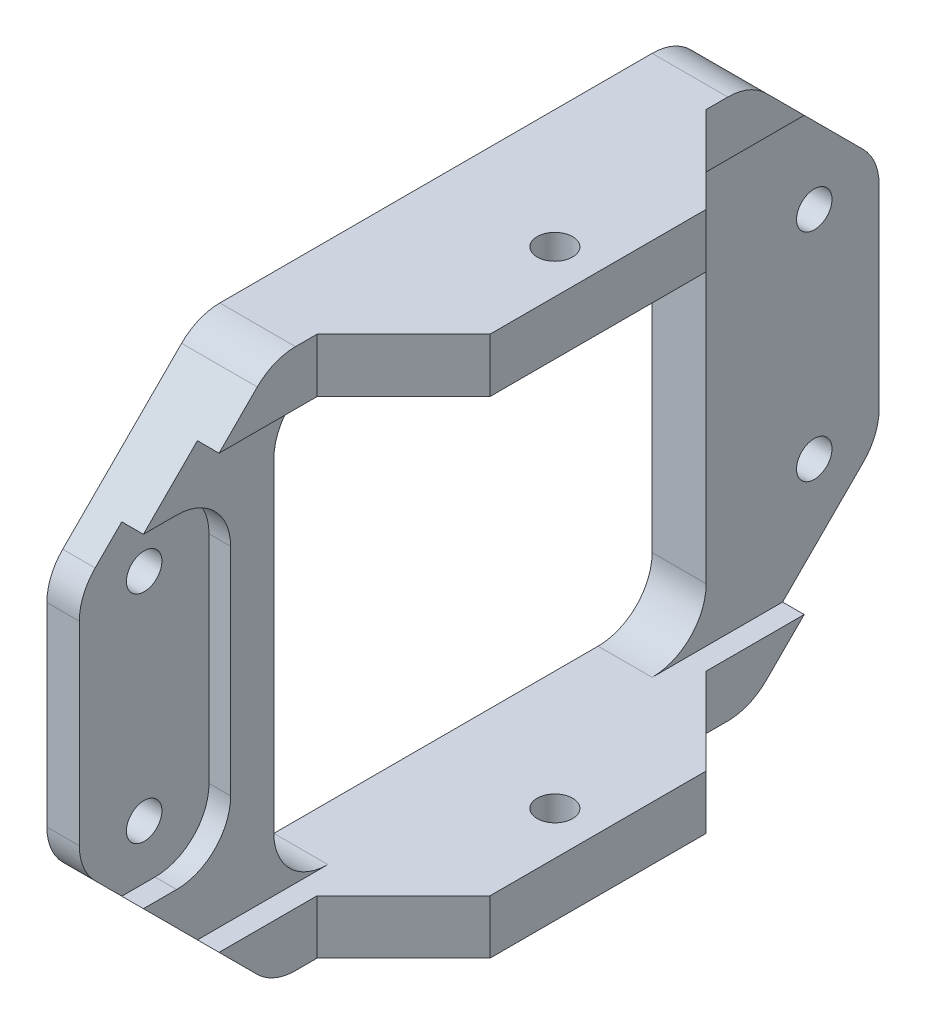
from build123d import *

# Parameters (mm, degrees)
SKETCH1_R           = 2.0828
BOSS_EXTRUDE1_DEPTH = 6.35
BOSS_EXTRUDE2_DEPTH = 12.7
SKETCH3_W           = 10.16
SKETCH3_H           = 8.980256121
SKETCH3_R           = 2.0828
CUT_EXTRUDE2_DEPTH  = 81.532421421
CUT_EXTRUDE3_DEPTH  = 2.54


with BuildPart() as part:
    # Sketch1 → Boss-Extrude1 (new body)
    with BuildSketch(Plane(origin=(0, 0, 0), x_dir=(0, 0, -1), z_dir=(1, 0, 0))):
        with BuildLine():
            Line((-25.4, 31.75), (25.4, 31.75))
            ThreePointArc((25.4, 31.75), (27.830039796, 31.266635031), (29.890128061, 29.890128061))
            Line((29.890128061, 29.890128061), (43.860128061, 15.920128061))
            ThreePointArc((43.860128061, 15.920128061), (45.236635031, 13.860039796), (45.72, 11.43))
            Line((45.72, 11.43), (45.72, -11.43))
            ThreePointArc((45.72, -11.43), (45.236635031, -13.860039796), (43.860128061, -15.920128061))
            Line((43.860128061, -15.920128061), (29.890128061, -29.890128061))
            ThreePointArc((29.890128061, -29.890128061), (27.830039796, -31.266635031), (25.4, -31.75))
            Line((25.4, -31.75), (-25.4, -31.75))
            ThreePointArc((-25.4, -31.75), (-27.830039796, -31.266635031), (-29.890128061, -29.890128061))
            Line((-29.890128061, -29.890128061), (-43.860128061, -15.920128061))
            ThreePointArc((-43.860128061, -15.920128061), (-45.236635031, -13.860039796), (-45.72, -11.43))
            Line((-45.72, -11.43), (-45.72, 11.43))
            ThreePointArc((-45.72, 11.43), (-45.236635031, 13.860039796), (-43.860128061, 15.920128061))
            Line((-43.860128061, 15.920128061), (-29.890128061, 29.890128061))
            ThreePointArc((-29.890128061, 29.890128061), (-27.830039796, 31.266635031), (-25.4, 31.75))
        make_face()
        with Locations((38.1, 12.7)):
            Circle(SKETCH1_R, mode=Mode.SUBTRACT)
        with Locations(Location((38.1, -12.7, 0), (0, 0, 180))):
            Circle(SKETCH1_R, mode=Mode.SUBTRACT)
        with Locations((-38.1, -12.7)):
            Circle(SKETCH1_R, mode=Mode.SUBTRACT)
        with Locations(Location((-38.1, 12.7, 0), (0, 0, 180))):
            Circle(SKETCH1_R, mode=Mode.SUBTRACT)
        with BuildLine():
            Line((-19.05, 25.4), (19.05, 25.4))
            ThreePointArc((19.05, 25.4), (23.540128061, 23.540128061), (25.4, 19.05))
            Line((25.4, 19.05), (25.4, -19.05))
            ThreePointArc((25.4, -19.05), (23.540128061, -23.540128061), (19.05, -25.4))
            Line((19.05, -25.4), (-19.05, -25.4))
            ThreePointArc((-19.05, -25.4), (-23.540128061, -23.540128061), (-25.4, -19.05))
            Line((-25.4, -19.05), (-25.4, 19.05))
            ThreePointArc((-25.4, 19.05), (-23.540128061, 23.540128061), (-19.05, 25.4))
        make_face(mode=Mode.SUBTRACT)
    extrude(amount=BOSS_EXTRUDE1_DEPTH)

    # Sketch2 → Boss-Extrude2 (add)
    with BuildSketch(Plane(origin=(6.35, 0, 0), x_dir=(0, 0, -1), z_dir=(1, 0, 0))):
        with BuildLine():
            Line((25.4, 31.75), (-25.4, 31.75))
            ThreePointArc((-25.4, 31.75), (-27.830039796, 31.266635031), (-29.890128061, 29.890128061))
            Line((-29.890128061, 29.890128061), (-34.380256121, 25.4))
            Line((-34.380256121, 25.4), (-19.05, 25.4))
            Line((-19.05, 25.4), (19.05, 25.4))
            Line((19.05, 25.4), (34.380256121, 25.4))
            Line((34.380256121, 25.4), (29.890128061, 29.890128061))
            ThreePointArc((29.890128061, 29.890128061), (27.830039796, 31.266635031), (25.4, 31.75))
        make_face()
    boss_extrude2 = extrude(amount=BOSS_EXTRUDE2_DEPTH)

    # Mirror1: Boss-Extrude2 across plane
    add(boss_extrude2.mirror(Plane.ZX))

    # Sketch3 → Cut-Extrude2 (cut, through all)
    with BuildSketch(Plane.XZ.offset(31.75)):
        with Locations((13.97, 29.890128061)):
            Rectangle(SKETCH3_W, SKETCH3_H)
        Polygon((8.89, 22.86), (19.05, 12.7), (19.05, 25.4), (8.89, 25.4), align=None)
        with Locations((13.97, -29.890128061)):
            Rectangle(SKETCH3_W, SKETCH3_H)
        Polygon((8.89, -25.4), (19.05, -25.4), (19.05, -12.7), (8.89, -22.86), align=None)
        with Locations(Location((13.97, 0, 0), (0, 0, 270))):
            Circle(SKETCH3_R)
    extrude(amount=-CUT_EXTRUDE2_DEPTH, mode=Mode.SUBTRACT)

    # Sketch5 → Cut-Extrude3 (cut)
    with BuildSketch(Plane(origin=(6.35, 0, 0), x_dir=(0, 0, -1), z_dir=(1, 0, 0))):
        with BuildLine():
            Line((-36.83, 19.05), (-45.72, 19.05))
            Line((-45.72, 19.05), (-45.72, -19.05))
            Line((-45.72, -19.05), (-36.83, -19.05))
            ThreePointArc((-36.83, -19.05), (-32.339871939, -17.190128061), (-30.48, -12.7))
            Line((-30.48, -12.7), (-30.48, 12.7))
            ThreePointArc((-30.48, 12.7), (-32.339871939, 17.190128061), (-36.83, 19.05))
        make_face()
    extrude(amount=-CUT_EXTRUDE3_DEPTH, mode=Mode.SUBTRACT)


solid = part.part
